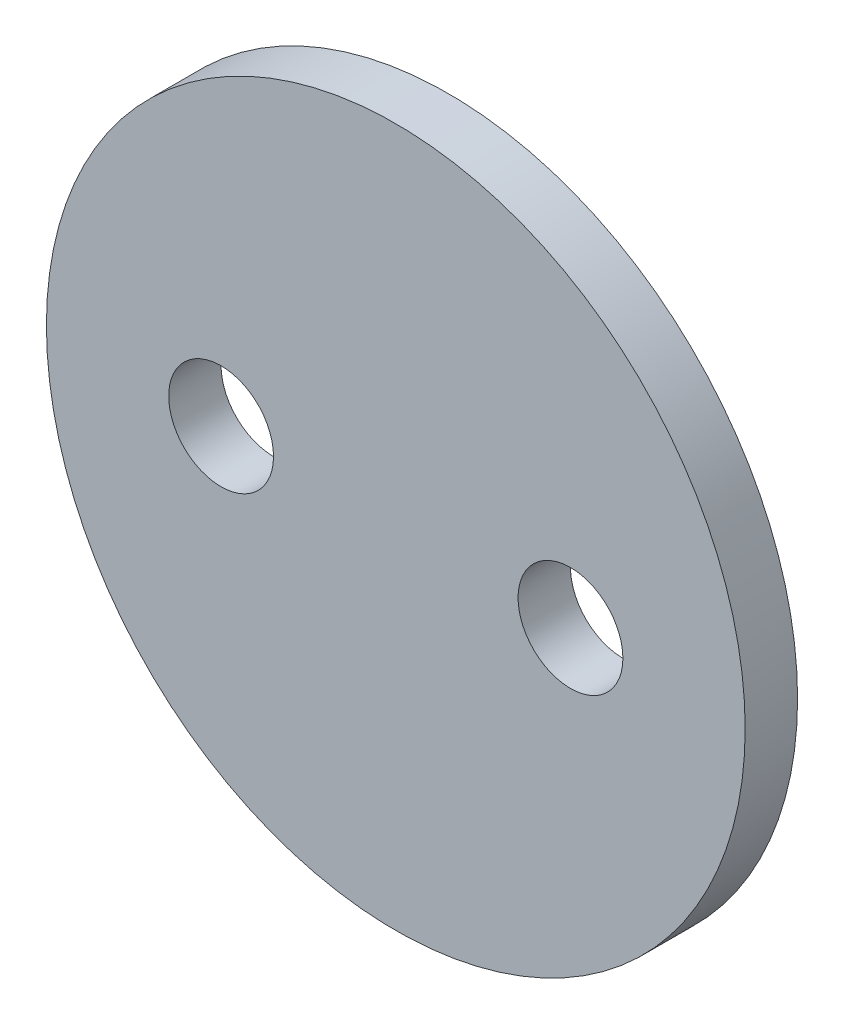
from build123d import *

# Parameters (mm, degrees)
SKETCH_1_R      = 10
SKETCH_1_R_2    = 1.5
EXTRUDE_1_DEPTH = 1.5


with BuildPart() as part:
    # Эскиз1 → Бобышка-Вытянуть1 (new body)
    with BuildSketch(Plane.XY):
        Circle(SKETCH_1_R)
        with Locations((-5, 0)):
            Circle(SKETCH_1_R_2, mode=Mode.SUBTRACT)
        with Locations((5, 0)):
            Circle(SKETCH_1_R_2, mode=Mode.SUBTRACT)
    extrude(amount=EXTRUDE_1_DEPTH)


solid = part.part
